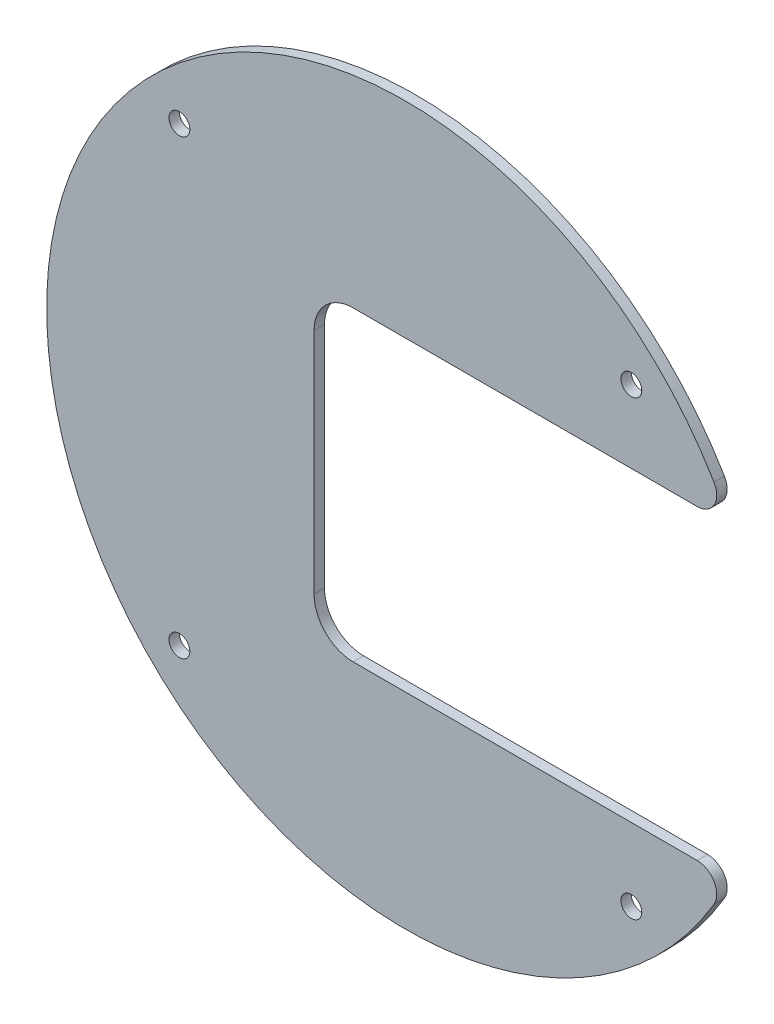
from build123d import *

# Parameters (mm, degrees)
SKETCH_1_R      = 1.6
EXTRUDE_1_DEPTH = 1.6
FILLET_1_R      = 6
FILLET_2_R      = 3


with BuildPart() as part:
    # 草圖1 → 填料-伸長1 (new body)
    with BuildSketch(Plane.XY):
        with BuildLine():
            Line((49.726753363, -23.5), (-14, -23.5))
            Line((-14, -23.5), (-14, 23.5))
            Line((-14, 23.5), (49.726753363, 23.5))
            ThreePointArc((49.726753363, 23.5), (-55, 0), (49.726753363, -23.5))
        make_face()
        with Locations((34.648232278, 34.648232278)):
            Circle(SKETCH_1_R, mode=Mode.SUBTRACT)
        with Locations((-34.648232278, 34.648232278)):
            Circle(SKETCH_1_R, mode=Mode.SUBTRACT)
        with Locations((-34.648232278, -34.648232278)):
            Circle(SKETCH_1_R, mode=Mode.SUBTRACT)
        with Locations((34.648232278, -34.648232278)):
            Circle(SKETCH_1_R, mode=Mode.SUBTRACT)
    extrude(amount=EXTRUDE_1_DEPTH)

    # 圓角1
    fillet_1_edges = [part.edges().sort_by_distance(p)[0] for p in [
        (-14, 23.5, 0.8),
        (-14, -23.5, 0.8),
    ]]
    fillet(fillet_1_edges, radius=FILLET_1_R)

    # 圓角2
    fillet_2_edges = [part.edges().sort_by_distance(p)[0] for p in [
        (49.726753363, 23.5, 0.8),
        (49.726753363, -23.5, 0.8),
    ]]
    fillet(fillet_2_edges, radius=FILLET_2_R)


solid = part.part
